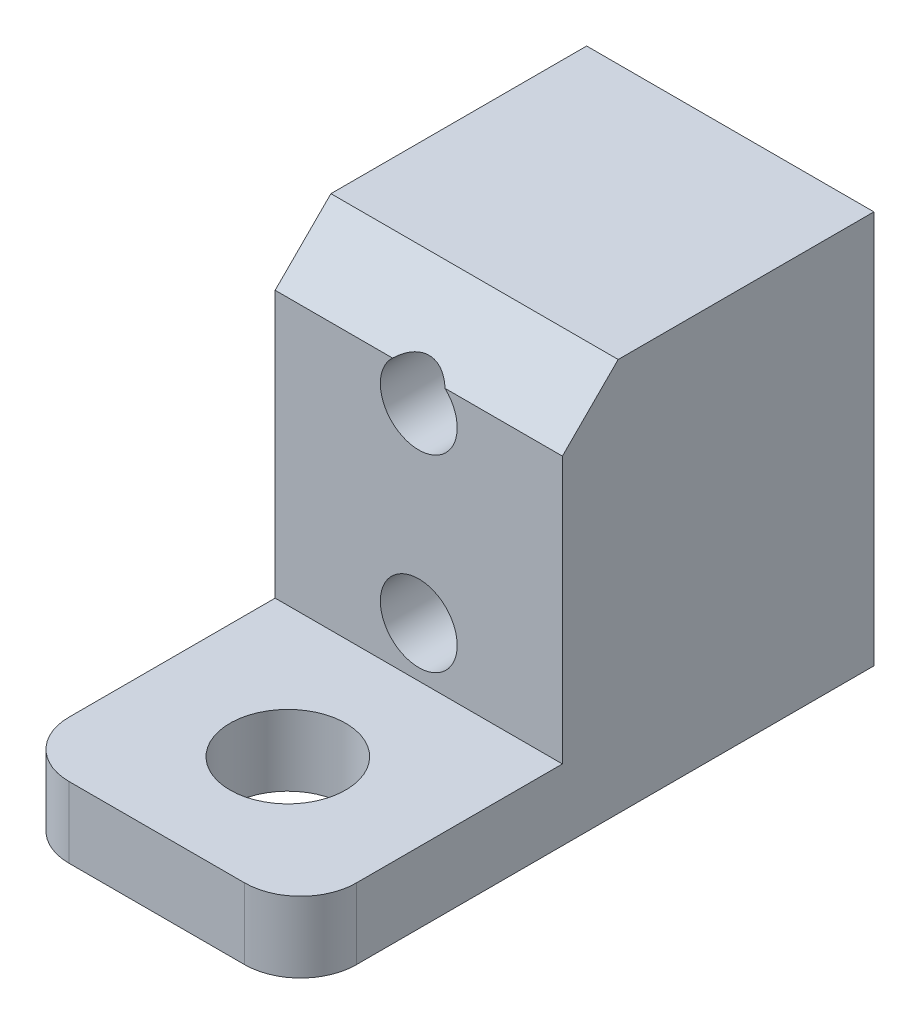
from build123d import *

# Parameters (mm, degrees)
SKETCH1_W           = 13.081
SKETCH1_H           = 17.907
BOSS_EXTRUDE1_DEPTH = 14.1859
SKETCH2_W           = 13.081
SKETCH2_H           = 3.2258
BOSS_EXTRUDE2_DEPTH = 11.9253
CHAMFER1_SIZE       = 2.54
FILLET1_R           = 2.54
SKETCH3_R           = 2.63525
CUT_EXTRUDE1_DEPTH  = 3.2258
SKETCH4_R           = 1.75
CUT_EXTRUDE2_DEPTH  = 29.367905597


with BuildPart() as part:
    # Sketch1 → Boss-Extrude1 (new body)
    with BuildSketch(Plane.XY):
        Rectangle(SKETCH1_W, SKETCH1_H)
    extrude(amount=BOSS_EXTRUDE1_DEPTH)

    # Sketch2 → Boss-Extrude2 (add)
    with BuildSketch(Plane.XY.offset(14.1859)):
        with Locations((0, -7.3406)):
            Rectangle(SKETCH2_W, SKETCH2_H)
    extrude(amount=BOSS_EXTRUDE2_DEPTH)

    # Chamfer1
    chamfer1_edges = [part.edges().sort_by_distance(p)[0] for p in [
        (0, 8.9535, 14.1859),
    ]]
    chamfer(chamfer1_edges, length=CHAMFER1_SIZE)

    # Fillet1
    fillet1_edges = [part.edges().sort_by_distance(p)[0] for p in [
        (-6.5405, -7.3406, 26.1112),
        (6.5405, -7.3406, 26.1112),
    ]]
    fillet(fillet1_edges, radius=FILLET1_R)

    # Sketch3 → Cut-Extrude1 (cut)
    with BuildSketch(Plane(origin=(0, -5.7277, 0), x_dir=(1, 0, 0), z_dir=(0, 1, 0))):
        with Locations(Location((0, -20.14855, 0), (0, 0, 270))):
            Circle(SKETCH3_R)
    extrude(amount=-CUT_EXTRUDE1_DEPTH, mode=Mode.SUBTRACT)

    # Sketch4 → Cut-Extrude2 (cut, through all)
    with BuildSketch(Plane(origin=(0, 0, 0), x_dir=(-1, 0, 0), z_dir=(0, 0, -1))):
        with Locations((0, 5.1334)):
            Circle(SKETCH4_R)
        with Locations((0, -3.4466)):
            Circle(SKETCH4_R)
    extrude(amount=-CUT_EXTRUDE2_DEPTH, mode=Mode.SUBTRACT)


solid = part.part
